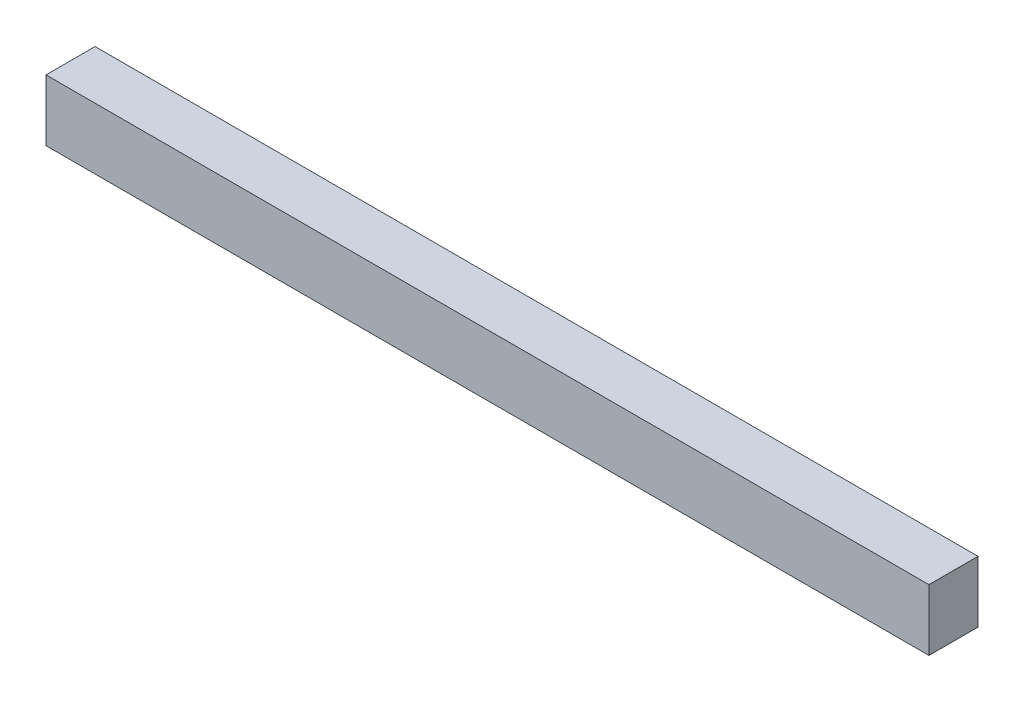
from build123d import *

# Parameters (mm, degrees)
SKETCH1_W           = 20
SKETCH1_H           = 25
BOSS_EXTRUDE1_DEPTH = 360


with BuildPart() as part:
    # Sketch1 → Boss-Extrude1 (new body)
    with BuildSketch(Plane(origin=(0, 0, 0), x_dir=(0, 0, -1), z_dir=(1, 0, 0))):
        Rectangle(SKETCH1_W, SKETCH1_H)
    extrude(amount=BOSS_EXTRUDE1_DEPTH)


solid = part.part
